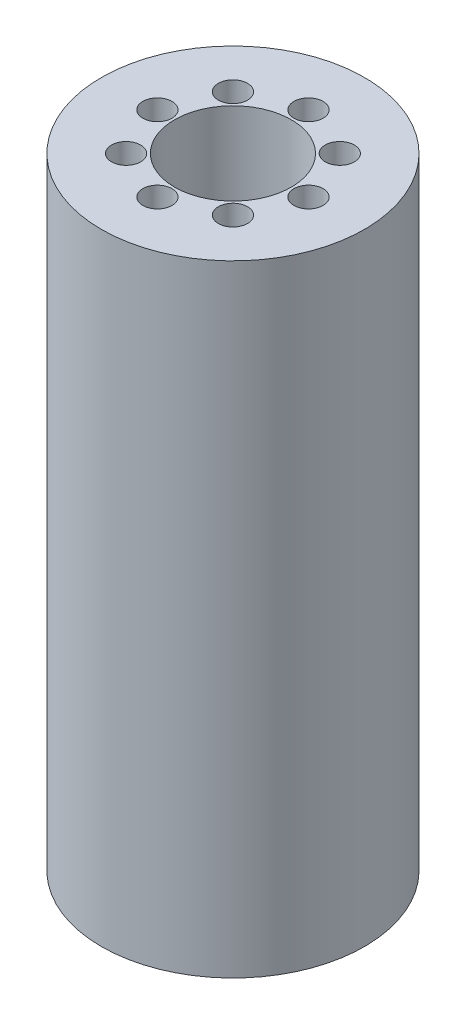
from build123d import *

# Parameters (mm, degrees)
SKETCH_1_R          = 67.58
SKETCH_1_R_2        = 30
EXTRUDE_1_DEPTH     = 319
CUT_EXTRUDE_1_REACH = 335.009
SKETCH_2_R          = 7.5


with BuildPart() as part:
    # 草图1 → 凸台-拉伸1 (new body)
    with BuildSketch(Plane(origin=(0, 0, 0), x_dir=(1, 0, 0), z_dir=(0, 1, 0))):
        with Locations(Location((0, 0, 0), (0, 0, 270))):
            Circle(SKETCH_1_R)
        with Locations(Location((0, 0, 0), (0, 0, 270))):
            Circle(SKETCH_1_R_2, mode=Mode.SUBTRACT)
    extrude(amount=EXTRUDE_1_DEPTH)

    # 草图2 → 切除-拉伸1 (cut, up to next)
    with BuildSketch(Plane(origin=(0, 319, 0), x_dir=(1, 0, 0), z_dir=(0, 1, 0)), mode=Mode.PRIVATE) as cut_extrude_1_sk1:
        with Locations(Location((-38.8, 0, 0), (0, 0, 270))):
            Circle(SKETCH_2_R)
    cut_extrude_1_tool1 = extrude(cut_extrude_1_sk1.sketch, amount=-CUT_EXTRUDE_1_REACH, mode=Mode.PRIVATE) & part.part
    # 草图2 → 切除-拉伸1 (cut, up to next)
    with BuildSketch(Plane(origin=(0, 319, 0), x_dir=(1, 0, 0), z_dir=(0, 1, 0)), mode=Mode.PRIVATE) as cut_extrude_1_sk2:
        with Locations(Location((-27.43574311, 27.43574311, 0), (0, 0, 270))):
            Circle(SKETCH_2_R)
    cut_extrude_1_tool2 = extrude(cut_extrude_1_sk2.sketch, amount=-CUT_EXTRUDE_1_REACH, mode=Mode.PRIVATE) & part.part
    # 草图2 → 切除-拉伸1 (cut, up to next)
    with BuildSketch(Plane(origin=(0, 319, 0), x_dir=(1, 0, 0), z_dir=(0, 1, 0)), mode=Mode.PRIVATE) as cut_extrude_1_sk3:
        with Locations(Location((0, 38.8, 0), (0, 0, 270))):
            Circle(SKETCH_2_R)
    cut_extrude_1_tool3 = extrude(cut_extrude_1_sk3.sketch, amount=-CUT_EXTRUDE_1_REACH, mode=Mode.PRIVATE) & part.part
    # 草图2 → 切除-拉伸1 (cut, up to next)
    with BuildSketch(Plane(origin=(0, 319, 0), x_dir=(1, 0, 0), z_dir=(0, 1, 0)), mode=Mode.PRIVATE) as cut_extrude_1_sk4:
        with Locations(Location((27.43574311, 27.43574311, 0), (0, 0, 270))):
            Circle(SKETCH_2_R)
    cut_extrude_1_tool4 = extrude(cut_extrude_1_sk4.sketch, amount=-CUT_EXTRUDE_1_REACH, mode=Mode.PRIVATE) & part.part
    # 草图2 → 切除-拉伸1 (cut, up to next)
    with BuildSketch(Plane(origin=(0, 319, 0), x_dir=(1, 0, 0), z_dir=(0, 1, 0)), mode=Mode.PRIVATE) as cut_extrude_1_sk5:
        with Locations(Location((38.8, 0, 0), (0, 0, 270))):
            Circle(SKETCH_2_R)
    cut_extrude_1_tool5 = extrude(cut_extrude_1_sk5.sketch, amount=-CUT_EXTRUDE_1_REACH, mode=Mode.PRIVATE) & part.part
    # 草图2 → 切除-拉伸1 (cut, up to next)
    with BuildSketch(Plane(origin=(0, 319, 0), x_dir=(1, 0, 0), z_dir=(0, 1, 0)), mode=Mode.PRIVATE) as cut_extrude_1_sk6:
        with Locations(Location((27.43574311, -27.43574311, 0), (0, 0, 270))):
            Circle(SKETCH_2_R)
    cut_extrude_1_tool6 = extrude(cut_extrude_1_sk6.sketch, amount=-CUT_EXTRUDE_1_REACH, mode=Mode.PRIVATE) & part.part
    # 草图2 → 切除-拉伸1 (cut, up to next)
    with BuildSketch(Plane(origin=(0, 319, 0), x_dir=(1, 0, 0), z_dir=(0, 1, 0)), mode=Mode.PRIVATE) as cut_extrude_1_sk7:
        with Locations(Location((0, -38.8, 0), (0, 0, 270))):
            Circle(SKETCH_2_R)
    cut_extrude_1_tool7 = extrude(cut_extrude_1_sk7.sketch, amount=-CUT_EXTRUDE_1_REACH, mode=Mode.PRIVATE) & part.part
    # 草图2 → 切除-拉伸1 (cut, up to next)
    with BuildSketch(Plane(origin=(0, 319, 0), x_dir=(1, 0, 0), z_dir=(0, 1, 0)), mode=Mode.PRIVATE) as cut_extrude_1_sk8:
        with Locations(Location((-27.43574311, -27.43574311, 0), (0, 0, 270))):
            Circle(SKETCH_2_R)
    cut_extrude_1_tool8 = extrude(cut_extrude_1_sk8.sketch, amount=-CUT_EXTRUDE_1_REACH, mode=Mode.PRIVATE) & part.part
    add(cut_extrude_1_tool1.solids().sort_by_distance((-38.8, 319, 0))[0], mode=Mode.SUBTRACT)
    add(cut_extrude_1_tool2.solids().sort_by_distance((-27.435743, 319, -27.435743))[0], mode=Mode.SUBTRACT)
    add(cut_extrude_1_tool3.solids().sort_by_distance((0, 319, -38.8))[0], mode=Mode.SUBTRACT)
    add(cut_extrude_1_tool4.solids().sort_by_distance((27.435743, 319, -27.435743))[0], mode=Mode.SUBTRACT)
    add(cut_extrude_1_tool5.solids().sort_by_distance((38.8, 319, 0))[0], mode=Mode.SUBTRACT)
    add(cut_extrude_1_tool6.solids().sort_by_distance((27.435743, 319, 27.435743))[0], mode=Mode.SUBTRACT)
    add(cut_extrude_1_tool7.solids().sort_by_distance((0, 319, 38.8))[0], mode=Mode.SUBTRACT)
    add(cut_extrude_1_tool8.solids().sort_by_distance((-27.435743, 319, 27.435743))[0], mode=Mode.SUBTRACT)


solid = part.part
